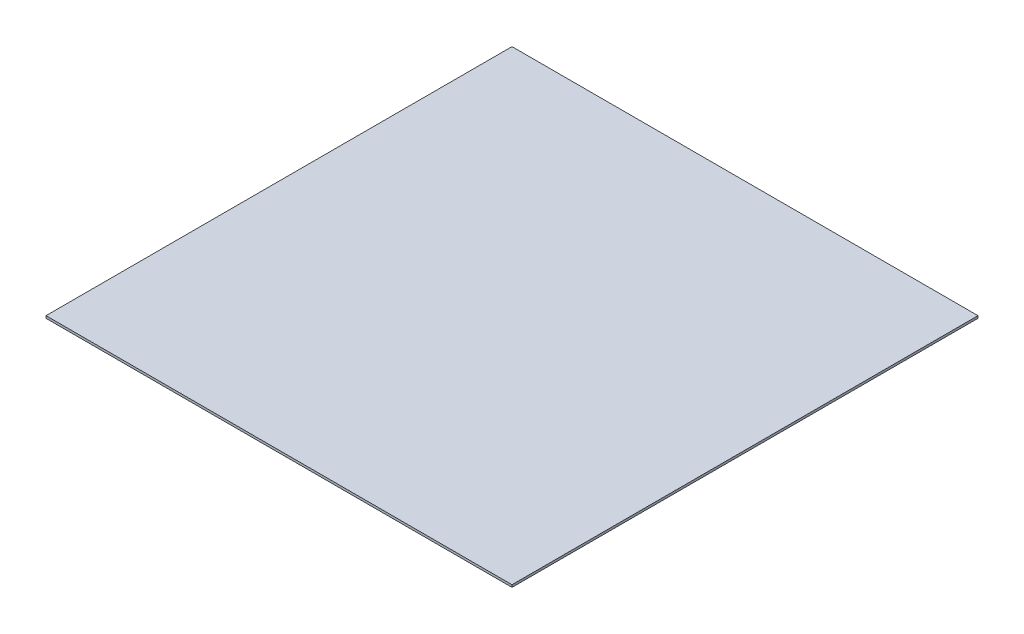
from build123d import *

# Parameters (mm, degrees)
SKETCH_1_W      = 20000
SKETCH_1_H      = 20000
EXTRUDE_1_DEPTH = 100


with BuildPart() as part:
    # 草图1 → 凸台-拉伸1 (new body)
    with BuildSketch(Plane(origin=(0, 0, 0), x_dir=(1, 0, 0), z_dir=(0, 1, 0))):
        Rectangle(SKETCH_1_W, SKETCH_1_H)
    extrude(amount=EXTRUDE_1_DEPTH)


solid = part.part
